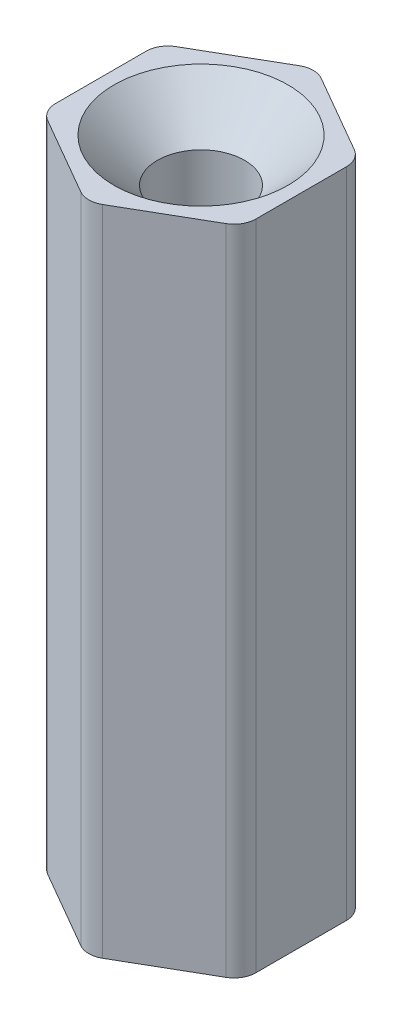
from build123d import *

# Parameters (mm, degrees)
BOSS_EXTRUDE1_DEPTH = 15
SKETCH2_R           = 1
CUT_EXTRUDE1_DEPTH  = 16.405951231
CHAMFER2_SIZE       = 1
FILLET1_R           = 0.5


with BuildPart() as part:
    # Sketch1 → Boss-Extrude1 (new body)
    with BuildSketch(Plane(origin=(0, 0, 0), x_dir=(1, 0, 0), z_dir=(0, 1, 0))):
        Polygon((0, 2.655811238), (-2.3, 1.327905619), (-2.3, -1.327905619), (0, -2.655811238), (2.3, -1.327905619), (2.3, 1.327905619), align=None)
    extrude(amount=BOSS_EXTRUDE1_DEPTH)

    # Sketch2 → Cut-Extrude1 (cut, through all)
    with BuildSketch(Plane(origin=(0, 15, 0), x_dir=(1, 0, 0), z_dir=(0, 1, 0))):
        with Locations(Location((0, 0, 0), (0, 0, 270))):
            Circle(SKETCH2_R)
    extrude(amount=-CUT_EXTRUDE1_DEPTH, mode=Mode.SUBTRACT)

    # Chamfer2
    chamfer2_edges = [part.edges().sort_by_distance(p)[0] for p in [
        (0, 0, -1),
        (0, 15, -1),
    ]]
    chamfer(chamfer2_edges, length=CHAMFER2_SIZE)

    # Fillet1
    fillet1_edges = [part.edges().sort_by_distance(p)[0] for p in [
        (2.3, 7.5, -1.327905619),
        (2.3, 7.5, 1.327905619),
        (0, 7.5, 2.655811238),
        (-2.3, 7.5, 1.327905619),
        (-2.3, 7.5, -1.327905619),
        (0, 7.5, -2.655811238),
    ]]
    fillet(fillet1_edges, radius=FILLET1_R)


solid = part.part
